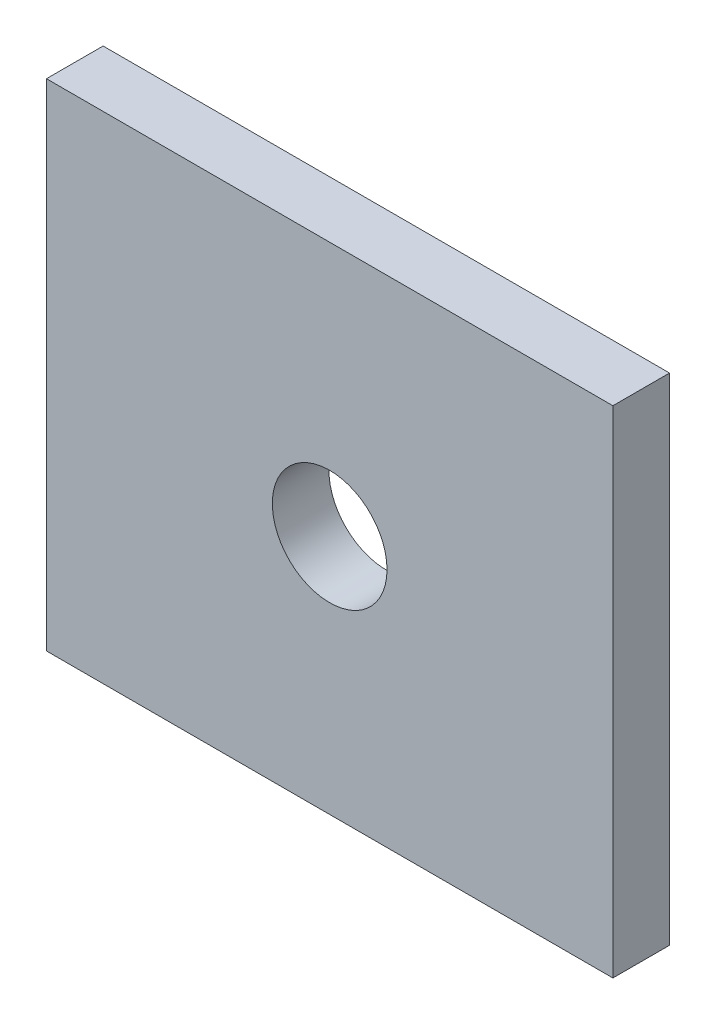
from build123d import *

# Parameters (mm, degrees)
SKETCH1_W                     = 40
SKETCH1_H                     = 35
PROFILE_DEPTH                 = 4
FASTENER_CLEARANCE_DEPTH      = 54.301031885
FASTENER_CLEARANCE_DEPTH_BACK = 54.301031885
SKETCH2_R                     = 4.05


with BuildPart() as part:
    # Sketch1 → Profile (new body)
    with BuildSketch(Plane.XY):
        with Locations((20, 17.5)):
            Rectangle(SKETCH1_W, SKETCH1_H)
    extrude(amount=PROFILE_DEPTH)

    # Sketch2 → Fastener_clearance (cut, two sides: drawn at the far end of the back side and taken through both)
    with BuildSketch(Plane.XY.offset(-FASTENER_CLEARANCE_DEPTH_BACK)):
        with Locations((20, 17)):
            Circle(SKETCH2_R)
    extrude(amount=FASTENER_CLEARANCE_DEPTH + FASTENER_CLEARANCE_DEPTH_BACK, mode=Mode.SUBTRACT)


solid = part.part
